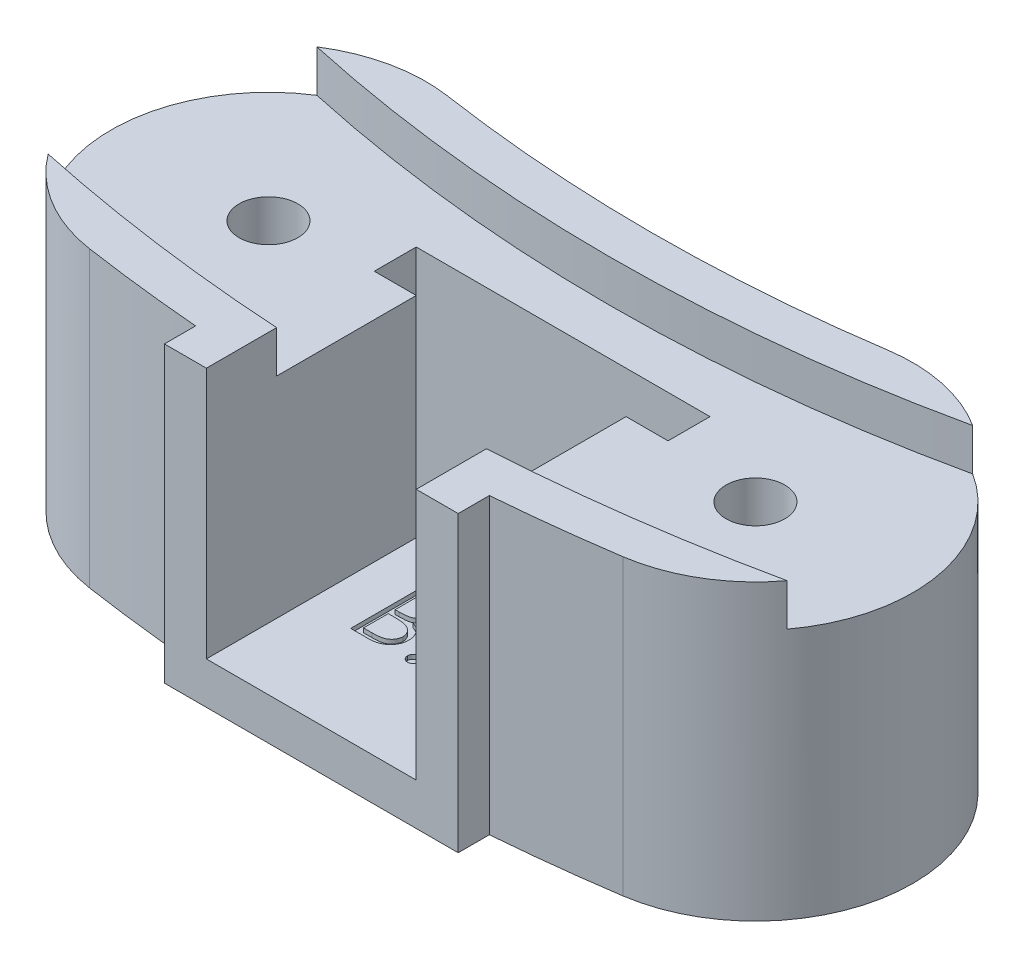
from build123d import *

# Parameters (mm, degrees)
SKETCH2_R                       = 1.4
BOSS_EXTRUDE1_DEPTH             = 12
BOSS_EXTRUDE5_DEPTH             = 2
BOSS_EXTRUDE2_REACH             = 30.617
BOSS_EXTRUDE2_END_RADIUS        = 86
SKETCH3_W                       = 14
SKETCH3_H                       = 14
BOSS_EXTRUDE2_DIRECTION_2_DEPTH = 1
SKETCH15_W                      = 10
SKETCH15_H                      = 10
SKETCH15_H_2                    = 2
CUT_EXTRUDE1_DEPTH              = 12
SKETCH16_W                      = 2
SKETCH16_H                      = 2
CUT_EXTRUDE2_DEPTH              = 10
CUT_EXTRUDE3_DEPTH              = 0.2


with BuildPart() as part:
    # Sketch2 → Boss-Extrude1 (new body)
    with BuildSketch(Plane(origin=(0, 0, 0), x_dir=(1, 0, 0), z_dir=(0, 1, 0))):
        with BuildLine():
            ThreePointArc((10.49446819, 8.279873701), (0, 7.5), (-10.49446819, 8.279873701))
            ThreePointArc((-10.49446819, 8.279873701), (-19.020657749, 1.97082531), (-12.711609357, -6.555364249))
            ThreePointArc((-12.711609357, -6.555364249), (0, -7.5), (12.711609357, -6.555364249))
            ThreePointArc((12.711609357, -6.555364249), (19.020657749, 1.97082531), (10.49446819, 8.279873701))
        make_face()
        with Locations(Location((-11.603038774, 0.862254726, 0), (0, 0, 270))):
            Circle(SKETCH2_R, mode=Mode.SUBTRACT)
        with Locations(Location((11.603038774, 0.862254726, 0), (0, 0, 270))):
            Circle(SKETCH2_R, mode=Mode.SUBTRACT)
    extrude(amount=BOSS_EXTRUDE1_DEPTH)

    # Sketch14 → Boss-Extrude5 (add)
    with BuildSketch(Plane(origin=(0, 12, 0), x_dir=(1, 0, 0), z_dir=(0, 1, 0))):
        with BuildLine():
            ThreePointArc((17.605627343, -3.634291778), (0, -5.5), (-17.605627343, -3.634291778))
            ThreePointArc((-17.605627343, -3.634291778), (-15.446905606, -5.577829728), (-12.711609357, -6.555364249))
            ThreePointArc((-12.711609357, -6.555364249), (0, -7.5), (12.711609357, -6.555364249))
            ThreePointArc((12.711609357, -6.555364249), (15.446905606, -5.577829728), (17.605627343, -3.634291778))
        make_face()
        with BuildLine():
            ThreePointArc((-10.49446819, 8.279873701), (-13.158435282, 8.199198347), (-15.625987479, 7.192016469))
            ThreePointArc((-15.625987479, 7.192016469), (0, 5.5), (15.625987479, 7.192016469))
            ThreePointArc((15.625987479, 7.192016469), (13.158435282, 8.199198347), (10.49446819, 8.279873701))
            ThreePointArc((10.49446819, 8.279873701), (0, 7.5), (-10.49446819, 8.279873701))
        make_face()
    extrude(amount=BOSS_EXTRUDE5_DEPTH)

    # Boss-Extrude2: up to this cylinder (the profile starts outside it)
    boss_extrude2_end = Plane(origin=(0, 7, -78.5), z_dir=(0, -1, 0)) * Cylinder(BOSS_EXTRUDE2_END_RADIUS, 234.234, mode=Mode.PRIVATE)
    # Sketch3 → Boss-Extrude2 (add, up to the surface)
    with BuildSketch(Plane.XY.offset(7.7), mode=Mode.PRIVATE) as boss_extrude2_sk1:
        with Locations((0, 7)):
            Rectangle(SKETCH3_W, SKETCH3_H)
    boss_extrude2_tool1 = extrude(boss_extrude2_sk1.sketch, amount=-BOSS_EXTRUDE2_REACH, mode=Mode.PRIVATE) - boss_extrude2_end
    add(boss_extrude2_tool1.solids().sort_by_distance((0, 7, 7.7))[0])

    # Sketch3 → Boss-Extrude2 direction 2 (add)
    with BuildSketch(Plane.XY.offset(7.7)):
        with Locations((0, 7)):
            Rectangle(SKETCH3_W, SKETCH3_H)
    extrude(amount=BOSS_EXTRUDE2_DIRECTION_2_DEPTH)

    # Sketch15 → Cut-Extrude1 (cut)
    with BuildSketch(Plane.XY.offset(8.7)):
        with Locations((0, 7)):
            Rectangle(SKETCH15_W, SKETCH15_H)
        with Locations((0, 13)):
            Rectangle(SKETCH15_W, SKETCH15_H_2)
    extrude(amount=-CUT_EXTRUDE1_DEPTH, mode=Mode.SUBTRACT)

    # Sketch16 → Cut-Extrude2 (cut)
    with BuildSketch(Plane(origin=(0, 12, 0), x_dir=(1, 0, 0), z_dir=(0, 1, 0))):
        with Locations((-6, 2.3)):
            Rectangle(SKETCH16_W, SKETCH16_H)
        with Locations((6, 2.3)):
            Rectangle(SKETCH16_W, SKETCH16_H)
    extrude(amount=-CUT_EXTRUDE2_DEPTH, mode=Mode.SUBTRACT)

    # Sketch17 → Cut-Extrude3 (cut)
    # profile 1 of 3: a face of its own
    with BuildSketch(Plane(origin=(0, 2, 0), x_dir=(1, 0, 0), z_dir=(0, 1, 0))):
        with BuildLine():
            Line((-2.821823485, -0.827400297), (-2.202342315, -0.827400297))
            add(Edge.make_bspline(
                [(-2.202342315, -0.827400297), (-2.17201791, -0.827559727), (-2.113241666, -0.827868744), (-2.027771172, -0.832661299), (-1.947716894, -0.839196056), (-1.873055614, -0.849564783), (-1.803821834, -0.862075895), (-1.739806906, -0.877226828), (-1.681214393, -0.895393828), (-1.611262125, -0.924282955), (-1.531505525, -0.967211829), (-1.445146983, -1.030647027), (-1.371301709, -1.10823719), (-1.307632693, -1.195760742), (-1.257013106, -1.292041049), (-1.220392386, -1.394783313), (-1.197207742, -1.502662322), (-1.194823377, -1.576724347), (-1.193618357, -1.614154103)],
                knots=[0, 0, 0, 0, 1.001505555, 1.941167018, 2.826882275, 3.653841531, 4.429895133, 5.150066043, 5.825578002, 6.45369114, 7.647487171, 8.808567382, 9.977351308, 11.170798116, 12.373658725, 13.556498008, 14.765093433, 16, 16, 16, 16], degree=3))
            add(Edge.make_bspline(
                [(-1.193618357, -1.614154103), (-1.194610062, -1.649217493), (-1.196558857, -1.71812036), (-1.215194074, -1.818898588), (-1.244368395, -1.914830051), (-1.284922442, -2.005564643), (-1.337629253, -2.089052278), (-1.400093585, -2.165966441), (-1.475456113, -2.233050614), (-1.531919623, -2.270554533), (-1.560600528, -2.289604824)],
                knots=[0, 0, 0, 0, 1.044552857, 2.05264487, 3.044412934, 4.028983338, 5.005914585, 5.980388656, 6.974128949, 8, 8, 8, 8], degree=3))
            add(Edge.make_bspline(
                [(-1.560600528, -2.289604824), (-1.52453214, -2.303452359), (-1.45552438, -2.329946123), (-1.360559211, -2.376786865), (-1.278739602, -2.427733923), (-1.209436476, -2.483370672), (-1.150165889, -2.543340808), (-1.098410721, -2.608523662), (-1.05424976, -2.679769535), (-1.01641018, -2.756335599), (-0.986883808, -2.837440038), (-0.96477138, -2.922322099), (-0.952100909, -3.01067741), (-0.950297834, -3.070807719), (-0.949387588, -3.101163318)],
                knots=[0, 0, 0, 0, 1.27268992, 2.434971085, 3.483601985, 4.442670788, 5.356604649, 6.2567628, 7.179492994, 8.113709626, 9.066344395, 10.018646069, 10.999752585, 12, 12, 12, 12], degree=3))
            add(Edge.make_bspline(
                [(-0.949387588, -3.101163318), (-0.950273726, -3.132157552), (-0.95201723, -3.193139575), (-0.96488049, -3.28272459), (-0.98666018, -3.368336149), (-1.016660434, -3.450527993), (-1.055814819, -3.529141115), (-1.103465187, -3.604264576), (-1.160280962, -3.675143576), (-1.223837994, -3.74256572), (-1.295740083, -3.80318807), (-1.373315089, -3.857177318), (-1.457539965, -3.901578389), (-1.547031417, -3.938876494), (-1.642793332, -3.96736731), (-1.744395697, -3.987299573), (-1.851750885, -4.000729857), (-1.925419731, -4.001834035), (-1.963199687, -4.002400297)],
                knots=[0, 0, 0, 0, 0.978564426, 1.925352924, 2.850884081, 3.763762016, 4.682927383, 5.618979971, 6.567305752, 7.547517671, 8.540179244, 9.531824382, 10.526200242, 11.540722885, 12.589160233, 13.674978461, 14.80764778, 16, 16, 16, 16], degree=3))
            Line((-1.963199687, -4.002400297), (-2.821823485, -4.002400297))
            Line((-2.821823485, -4.002400297), (-2.821823485, -0.827400297))
        make_face()
        with BuildLine():
            Line((-2.536887588, -1.153041322), (-2.536887588, -2.170669528))
            Line((-2.536887588, -2.170669528), (-2.345446281, -2.170669528))
            add(Edge.make_bspline(
                [(-2.345446281, -2.170669528), (-2.317462017, -2.17030674), (-2.263390716, -2.169605761), (-2.185086238, -2.167597785), (-2.1124014, -2.161975274), (-2.045461666, -2.156354379), (-1.984372449, -2.147215289), (-1.929269089, -2.13633672), (-1.87928679, -2.124831514), (-1.821647345, -2.105264908), (-1.756266885, -2.076347302), (-1.686568283, -2.03146928), (-1.625123443, -1.978016474), (-1.573237422, -1.916338958), (-1.530772731, -1.848424632), (-1.501278147, -1.775357105), (-1.481278111, -1.698957414), (-1.479471507, -1.646507999), (-1.478554254, -1.619878261)],
                knots=[0, 0, 0, 0, 1.156816544, 2.235205308, 3.236616184, 4.169592532, 5.011045266, 5.787822928, 6.49130361, 7.128639758, 8.301311294, 9.436451833, 10.541879658, 11.654887649, 12.756523258, 13.837046038, 14.901820046, 16, 16, 16, 16], degree=3))
            add(Edge.make_bspline(
                [(-1.478554254, -1.619878261), (-1.479031575, -1.602256312), (-1.479967891, -1.567688933), (-1.487636244, -1.517297733), (-1.500669687, -1.469905186), (-1.517410367, -1.424861814), (-1.540804392, -1.383576065), (-1.568348391, -1.344620451), (-1.601627553, -1.309321601), (-1.639507401, -1.27632927), (-1.68305808, -1.247078877), (-1.732253609, -1.221460471), (-1.787759573, -1.200831338), (-1.84864052, -1.182764542), (-1.915833578, -1.170075161), (-1.988563352, -1.159503874), (-2.067425561, -1.154122029), (-2.121985761, -1.153409593), (-2.15018887, -1.153041322)],
                knots=[0, 0, 0, 0, 0.91205012, 1.789085906, 2.630437955, 3.453916878, 4.269457761, 5.079663411, 5.91843418, 6.774407191, 7.675494373, 8.627863946, 9.638891023, 10.736472738, 11.911756761, 13.175263542, 14.539845004, 16, 16, 16, 16], degree=3))
            Line((-2.15018887, -1.153041322), (-2.536887588, -1.153041322))
        make_face(mode=Mode.SUBTRACT)
        with BuildLine():
            Line((-2.536887588, -2.496310553), (-2.536887588, -3.676759271))
            Line((-2.536887588, -3.676759271), (-2.131108341, -3.676759271))
            add(Edge.make_bspline(
                [(-2.131108341, -3.676759271), (-2.102062601, -3.676411157), (-2.046080766, -3.675740214), (-1.965253222, -3.673549868), (-1.890338549, -3.66856759), (-1.821678597, -3.660724569), (-1.758531972, -3.652216976), (-1.701656199, -3.640776742), (-1.650590231, -3.627669471), (-1.591377109, -3.607409186), (-1.524698926, -3.57593453), (-1.452843364, -3.528478053), (-1.388956723, -3.47194191), (-1.334704809, -3.406508866), (-1.290243027, -3.335360448), (-1.257898435, -3.259935738), (-1.237949587, -3.18148101), (-1.235534619, -3.127989778), (-1.234323485, -3.101163318)],
                knots=[0, 0, 0, 0, 1.160039823, 2.235823828, 3.228722157, 4.157150951, 4.99529583, 5.772374946, 6.472645482, 7.099169577, 8.269452708, 9.405989375, 10.527446681, 11.663510218, 12.788923519, 13.866172445, 14.929861265, 16, 16, 16, 16], degree=3))
            add(Edge.make_bspline(
                [(-1.234323485, -3.101163318), (-1.234573951, -3.084387216), (-1.235070843, -3.051105612), (-1.242564401, -3.002196262), (-1.253462697, -2.954819934), (-1.267551926, -2.908847984), (-1.288071015, -2.865111564), (-1.312025523, -2.822745671), (-1.340111938, -2.7816943), (-1.383876288, -2.729794613), (-1.447532303, -2.669998465), (-1.537980592, -2.611453731), (-1.640825462, -2.564238935), (-1.715417545, -2.544191553), (-1.753949887, -2.533835593)],
                knots=[0, 0, 0, 0, 0.723448775, 1.435228256, 2.130040452, 2.821711965, 3.505591119, 4.210454504, 4.921174351, 5.648778258, 7.137944449, 8.670945889, 10.280296675, 12, 12, 12, 12], degree=3))
            add(Edge.make_bspline(
                [(-1.753949887, -2.533835593), (-1.76939771, -2.530701338), (-1.802891776, -2.523905628), (-1.857508652, -2.516732211), (-1.919861905, -2.510341335), (-1.990095515, -2.505614071), (-2.068298342, -2.500727706), (-2.154637404, -2.498827404), (-2.248760111, -2.496560218), (-2.314067477, -2.496395904), (-2.347990352, -2.496310553)],
                knots=[0, 0, 0, 0, 0.634451884, 1.375622551, 2.216452059, 3.157844607, 4.20941857, 5.370758133, 6.634282058, 8, 8, 8, 8], degree=3))
            Line((-2.347990352, -2.496310553), (-2.536887588, -2.496310553))
        make_face(mode=Mode.SUBTRACT)
    # profile 2 of 3: a face of its own
    with BuildSketch(Plane(origin=(0, 2, 0), x_dir=(1, 0, 0), z_dir=(0, 1, 0))):
        with BuildLine():
            add(Edge.make_bspline(
                [(-0.074227331, -3.513938758), (-0.056546924, -3.514989381), (-0.021886554, -3.517049004), (0.028223227, -3.531179272), (0.073575525, -3.556269628), (0.113972633, -3.589709434), (0.147270651, -3.630254786), (0.17325517, -3.67524536), (0.18726235, -3.725774662), (0.18930697, -3.760635867), (0.190356002, -3.778522092)],
                knots=[0, 0, 0, 0, 1.020151414, 1.999887582, 2.974338812, 3.990962822, 5.007586832, 5.987933904, 6.967670073, 8, 8, 8, 8], degree=3))
            add(Edge.make_bspline(
                [(0.190356002, -3.778522092), (0.189271421, -3.795978541), (0.187132644, -3.830402402), (0.173287278, -3.880550586), (0.147072619, -3.925569278), (0.114202304, -3.966664789), (0.073565539, -4.000175436), (0.028116007, -4.025052327), (-0.02176892, -4.040194338), (-0.056527299, -4.042123193), (-0.074227331, -4.043105425)],
                knots=[0, 0, 0, 0, 1.009421747, 1.99056486, 2.972319754, 3.999869655, 5.017953583, 5.993804169, 6.978383603, 8, 8, 8, 8], degree=3))
            add(Edge.make_bspline(
                [(-0.074227331, -4.043105425), (-0.091940117, -4.042158733), (-0.126520115, -4.040310543), (-0.176218838, -4.024741426), (-0.22194516, -4.000408716), (-0.262574012, -3.966602305), (-0.295719626, -3.925780746), (-0.320779795, -3.880240545), (-0.33582943, -3.830545955), (-0.3378087, -3.796006815), (-0.338810664, -3.778522092)],
                knots=[0, 0, 0, 0, 1.022052826, 1.995314843, 2.982371812, 4.00089066, 5.028879526, 6.005146991, 6.990147033, 8, 8, 8, 8], degree=3))
            add(Edge.make_bspline(
                [(-0.338810664, -3.778522092), (-0.337847189, -3.760606583), (-0.335966121, -3.725628751), (-0.3207482, -3.675555275), (-0.295914065, -3.630045334), (-0.262344885, -3.589771293), (-0.221954988, -3.556037097), (-0.176329145, -3.531485463), (-0.126400419, -3.516934518), (-0.091919975, -3.514954663), (-0.074227331, -3.513938758)],
                knots=[0, 0, 0, 0, 1.032775665, 2.016367738, 2.991239715, 4.008302682, 5.025365648, 6.011011707, 6.979408107, 8, 8, 8, 8], degree=3))
        make_face()
    # profile 3 of 3: a face of its own
    with BuildSketch(Plane(origin=(0, 2, 0), x_dir=(1, 0, 0), z_dir=(0, 1, 0))):
        with BuildLine():
            Line((1.004458566, -1.804323374), (0.719522669, -1.804323374))
            add(Edge.make_bspline(
                [(0.719522669, -1.804323374), (0.721379729, -1.766521925), (0.725026946, -1.692280887), (0.742106894, -1.584037058), (0.766546118, -1.480573062), (0.801100509, -1.38271964), (0.844014061, -1.289611579), (0.8954763, -1.201618708), (0.956430721, -1.119076701), (1.025561116, -1.04275075), (1.100644096, -0.972730597), (1.181657341, -0.912264769), (1.266788187, -0.861176596), (1.355778356, -0.818467184), (1.449631867, -0.786408895), (1.547497031, -0.762622122), (1.649803819, -0.748310722), (1.719508696, -0.746772403), (1.754959368, -0.74599004)],
                knots=[0, 0, 0, 0, 1.10065271, 2.161652631, 3.183658789, 4.190468796, 5.17591951, 6.163126047, 7.15150782, 8.156236427, 9.156009102, 10.134482811, 11.092018607, 12.041330605, 13.001268258, 13.972401359, 14.968799086, 16, 16, 16, 16], degree=3))
            add(Edge.make_bspline(
                [(1.754959368, -0.74599004), (1.789773763, -0.746805069), (1.858182807, -0.74840657), (1.958024778, -0.76215979), (2.053072752, -0.783700434), (2.14314094, -0.813922275), (2.227510727, -0.854548149), (2.306815918, -0.903350202), (2.382000653, -0.959792477), (2.449679664, -1.026244151), (2.511826279, -1.097184886), (2.565440467, -1.172920341), (2.611353837, -1.251142622), (2.64962409, -1.332448204), (2.677796444, -1.417602637), (2.699185247, -1.505366171), (2.711275115, -1.59664725), (2.713130607, -1.658429625), (2.714073951, -1.689840201)],
                knots=[0, 0, 0, 0, 1.111607364, 2.184268762, 3.212621178, 4.221274766, 5.211760367, 6.196651075, 7.1921475, 8.207485113, 9.220403448, 10.201281604, 11.166441695, 12.114753415, 13.065576456, 14.026450734, 14.996634279, 16, 16, 16, 16], degree=3))
            add(Edge.make_bspline(
                [(2.714073951, -1.689840201), (2.71253792, -1.734061451), (2.709492812, -1.82172793), (2.683444771, -1.950555698), (2.642762578, -2.075372586), (2.593779262, -2.175827138), (2.544364973, -2.256774665), (2.499835591, -2.323421276), (2.447706798, -2.395181236), (2.387219875, -2.47181425), (2.319626056, -2.553920571), (2.244313093, -2.641450599), (2.160743934, -2.73349999), (2.102089437, -2.796370072), (2.071696146, -2.828947773)],
                knots=[0, 0, 0, 0, 1.184426356, 2.348067706, 3.509069118, 4.696110526, 5.333549288, 6.050745305, 6.844228056, 7.710549037, 8.667450064, 9.695053472, 10.805634456, 12, 12, 12, 12], degree=3))
            Line((2.071696146, -2.828947773), (1.277310129, -3.676759271))
            Line((1.277310129, -3.676759271), (2.754779079, -3.676759271))
            Line((2.754779079, -3.676759271), (2.754779079, -4.002400297))
            Line((2.754779079, -4.002400297), (0.597407284, -4.002400297))
            Line((0.597407284, -4.002400297), (1.828737412, -2.688387877))
            add(Edge.make_bspline(
                [(1.828737412, -2.688387877), (1.858716567, -2.657092985), (1.916300387, -2.596981901), (1.99774601, -2.509222216), (2.070897093, -2.427806561), (2.136227156, -2.352888763), (2.192318979, -2.283372984), (2.242095932, -2.221510646), (2.281979004, -2.164583394), (2.325263684, -2.098597266), (2.367186367, -2.018031807), (2.403211148, -1.919576246), (2.425177474, -1.818223667), (2.427812575, -1.749732533), (2.429138053, -1.715280906)],
                knots=[0, 0, 0, 0, 1.329631726, 2.553950428, 3.673215718, 4.687767853, 5.603093632, 6.413772471, 7.123043292, 7.734684054, 8.834405432, 9.900288307, 10.943827018, 12, 12, 12, 12], degree=3))
            add(Edge.make_bspline(
                [(2.429138053, -1.715280906), (2.428561344, -1.693617066), (2.427424762, -1.650921797), (2.41739385, -1.588323716), (2.402235034, -1.52793992), (2.380513264, -1.469584673), (2.351841436, -1.413844689), (2.316940584, -1.360652117), (2.276672455, -1.309227128), (2.230089518, -1.261009493), (2.17891621, -1.216848685), (2.124855713, -1.177728979), (2.067660261, -1.145036357), (2.007571007, -1.118236185), (1.944755474, -1.097212803), (1.87909217, -1.082645377), (1.810762526, -1.073499124), (1.764104998, -1.072261625), (1.740330962, -1.071631066)],
                knots=[0, 0, 0, 0, 0.991446411, 1.95395049, 2.89581595, 3.838931463, 4.798493298, 5.75982156, 6.748411868, 7.785213223, 8.824556874, 9.840280684, 10.836137867, 11.835679398, 12.848801643, 13.863922112, 14.911575587, 16, 16, 16, 16], degree=3))
            add(Edge.make_bspline(
                [(1.740330962, -1.071631066), (1.715501707, -1.072279702), (1.666741149, -1.073553517), (1.595150312, -1.082464077), (1.526855356, -1.097836375), (1.461684487, -1.118860929), (1.399527434, -1.145584042), (1.34068648, -1.178868696), (1.285293716, -1.218586579), (1.233245013, -1.263617655), (1.185289832, -1.313753264), (1.14315588, -1.369642302), (1.106340382, -1.430264315), (1.074219149, -1.495455729), (1.04813363, -1.565808086), (1.028200843, -1.641071647), (1.012428489, -1.720919614), (1.007159331, -1.77606037), (1.004458566, -1.804323374)],
                knots=[0, 0, 0, 0, 1.031018746, 2.02475058, 2.990194455, 3.934040569, 4.864654155, 5.795059489, 6.735614925, 7.690564532, 8.649604399, 9.611025574, 10.590972636, 11.591080095, 12.624614302, 13.701020113, 14.821632451, 16, 16, 16, 16], degree=3))
        make_face()
    extrude(amount=-CUT_EXTRUDE3_DEPTH, mode=Mode.SUBTRACT)


solid = part.part
